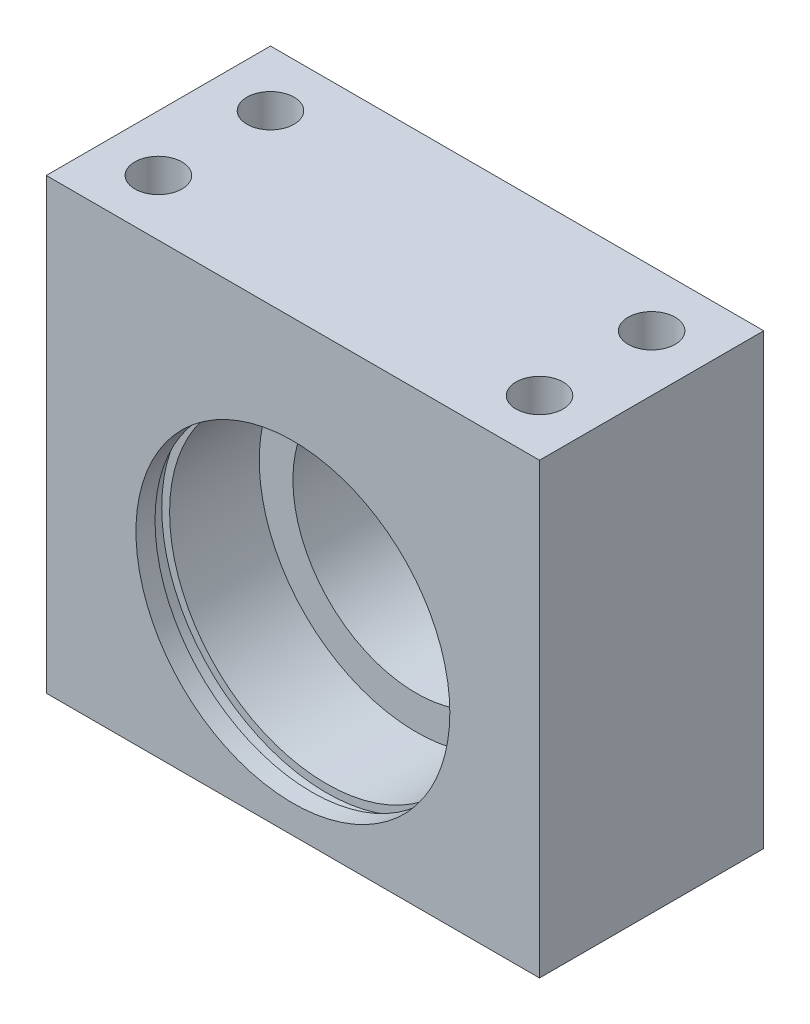
from build123d import *

# Parameters (mm, degrees)
SZKIC1_W                       = 44
SZKIC1_H                       = 20
DODANIE_WYCI_GNI_CIE1_DEPTH    = 40
SZKIC3_R                       = 11
WYTNIJ_WYCI_GNI_CIE2_DEPTH     = 50.839743178
SZKIC4_R                       = 14
WYTNIJ_WYCI_GNI_CIE3_DEPTH     = 11
OTW_R_GWINTOWANY_M5X0_81_D     = 4.2
OTW_R_GWINTOWANY_M5X0_81_DEPTH = 25
OTW_R_GWINTOWANY_M5X0_81_TIP   = 1.2618073
SZKIC5_W                       = 1.3
SZKIC5_H                       = 0.7


with BuildPart() as part:
    # Szkic1 → Dodanie-wyciągnięcie1 (new body)
    with BuildSketch(Plane(origin=(0, 0, 0), x_dir=(1, 0, 0), z_dir=(0, 1, 0))):
        Rectangle(SZKIC1_W, SZKIC1_H)
    extrude(amount=DODANIE_WYCI_GNI_CIE1_DEPTH)

    # Szkic3 → Wytnij-wyciągnięcie2 (cut, through all)
    with BuildSketch(Plane.XY.offset(10)):
        with Locations((0, 16.5)):
            Circle(SZKIC3_R)
    extrude(amount=-WYTNIJ_WYCI_GNI_CIE2_DEPTH, mode=Mode.SUBTRACT)

    # Szkic4 → Wytnij-wyciągnięcie3 (cut)
    with BuildSketch(Plane.XY.offset(10)):
        with Locations((0, 16.5)):
            Circle(SZKIC4_R)
    extrude(amount=-WYTNIJ_WYCI_GNI_CIE3_DEPTH, mode=Mode.SUBTRACT)

    # Otwór gwintowany M5x0.81
    with Locations(Plane(origin=(0, 40, 0), x_dir=(1, 0, 0), z_dir=(0, 1, 0))):
        with Locations((17, 5), (17, -5), (-17, -5), (-17, 5)):
            Hole(OTW_R_GWINTOWANY_M5X0_81_D / 2, depth=OTW_R_GWINTOWANY_M5X0_81_DEPTH)
            with Locations((0, 0, -(OTW_R_GWINTOWANY_M5X0_81_DEPTH + OTW_R_GWINTOWANY_M5X0_81_TIP / 2))):  # 118° drill point
                Cone(0, OTW_R_GWINTOWANY_M5X0_81_D / 2, OTW_R_GWINTOWANY_M5X0_81_TIP, mode=Mode.SUBTRACT)

    # Szkic5 → Wycięcie-obrót1 (revolve, cut)
    with BuildSketch(Plane(origin=(0, 0, 0), x_dir=(0, 0, -1), z_dir=(1, 0, 0)), mode=Mode.PRIVATE) as wyci_cie_obr_t1_sk:
        with Locations((-7.65, 2.15)):
            Rectangle(SZKIC5_W, SZKIC5_H)
    revolve(wyci_cie_obr_t1_sk.sketch.rotate(Axis((0, 16.5, 9.294649117), (0, 0, 1)), 90), axis=Axis((0, 16.5, 9.294649117), (0, 0, 1)), mode=Mode.SUBTRACT)


solid = part.part
